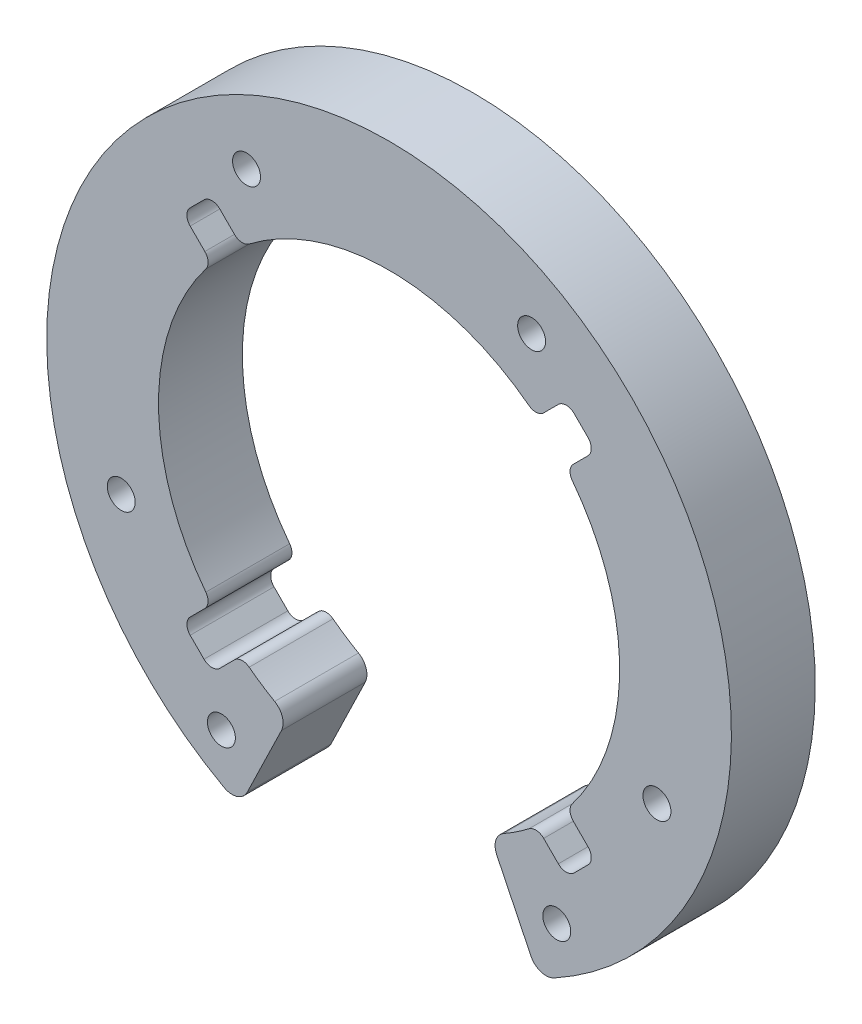
from build123d import *

# Parameters (mm, degrees)
ESQUISSE1_R                  = 61.25
ESQUISSE1_R_2                = 41.25
BOSS_EXTRU_1_DEPTH           = 15
ENL_V_MAT_EXTRU_1_DEPTH      = 88.909754863
ENL_V_MAT_EXTRU_1_DEPTH_BACK = 88.909754863
ENL_V_MAT_EXTRU_2_DEPTH      = 88.909754863
ENL_V_MAT_EXTRU_2_DEPTH_BACK = 88.909754863
CONG_1_R                     = 2
CONG_2_R                     = 3
ENL_V_MAT_EXTRU_3_DEPTH      = 88.909754863
ENL_V_MAT_EXTRU_3_DEPTH_BACK = 88.909754863
ESQUISSE4_R                  = 2.5


with BuildPart() as part:
    # Esquisse1 → Boss.-Extru.1 (new body)
    with BuildSketch(Plane.XY):
        Circle(ESQUISSE1_R)
        Circle(ESQUISSE1_R_2, mode=Mode.SUBTRACT)
    extrude(amount=BOSS_EXTRU_1_DEPTH)

    # Esquisse2 → Enlèv. mat.-Extru.1 (cut, two sides: drawn at the far end of the back side and taken through both)
    with BuildSketch(Plane.XY.offset(15).offset(-ENL_V_MAT_EXTRU_1_DEPTH_BACK)):
        Polygon((26.395724667, 31.699025526), (31.699025526, 26.395724667), (37.002326385, 31.699025526), (31.699025526, 37.002326385), align=None)
        Polygon((31.699025526, -26.395724667), (26.395724667, -31.699025526), (31.699025526, -37.002326385), (37.002326385, -31.699025526), align=None)
        Polygon((-26.395724667, -31.699025526), (-31.699025526, -26.395724667), (-37.002326385, -31.699025526), (-31.699025526, -37.002326385), align=None)
        Polygon((-31.699025526, 26.395724667), (-26.395724667, 31.699025526), (-31.699025526, 37.002326385), (-37.002326385, 31.699025526), align=None)
    extrude(amount=ENL_V_MAT_EXTRU_1_DEPTH + ENL_V_MAT_EXTRU_1_DEPTH_BACK, mode=Mode.SUBTRACT)

    # Esquisse3 → Enlèv. mat.-Extru.2 (cut, two sides: drawn at the far end of the back side and taken through both)
    with BuildSketch(Plane.XY.offset(15).offset(-ENL_V_MAT_EXTRU_2_DEPTH_BACK)):
        with BuildLine():
            Line((-26.727272727, -55.110937141), (-18, -37.115529095))
            ThreePointArc((-18, -37.115529095), (0, -41.25), (18, -37.115529095))
            Line((18, -37.115529095), (26.727272727, -55.110937141))
            ThreePointArc((26.727272727, -55.110937141), (0, -61.25), (-26.727272727, -55.110937141))
        make_face()
    extrude(amount=ENL_V_MAT_EXTRU_2_DEPTH + ENL_V_MAT_EXTRU_2_DEPTH_BACK, mode=Mode.SUBTRACT)

    # Congé1
    cong_1_edges = [part.edges().sort_by_distance(p)[0] for p in [
        (-31.699025526, 37.002326385, 7.5),
        (-26.395724667, 31.699025526, 7.5),
        (-31.699025526, 26.395724667, 7.5),
        (-37.002326385, 31.699025526, 7.5),
        (-37.002326385, -31.699025526, 7.5),
        (-31.699025526, -26.395724667, 7.5),
        (-26.395724667, -31.699025526, 7.5),
        (-31.699025526, -37.002326385, 7.5),
        (31.699025526, -37.002326385, 7.5),
        (26.395724667, -31.699025526, 7.5),
        (31.699025526, -26.395724667, 7.5),
        (37.002326385, -31.699025526, 7.5),
        (37.002326385, 31.699025526, 7.5),
        (31.699025526, 26.395724667, 7.5),
        (26.395724667, 31.699025526, 7.5),
        (31.699025526, 37.002326385, 7.5),
    ]]
    fillet(cong_1_edges, radius=CONG_1_R)

    # Congé2
    cong_2_edges = [part.edges().sort_by_distance(p)[0] for p in [
        (-18, -37.115529095, 7.5),
        (18, -37.115529095, 7.5),
        (26.727272727, -55.110937141, 7.5),
        (-26.727272727, -55.110937141, 7.5),
    ]]
    fillet(cong_2_edges, radius=CONG_2_R)

    # Esquisse4 → Enlèv. mat.-Extru.3 (cut, two sides: drawn at the far end of the back side and taken through both)
    with BuildSketch(Plane.XY.offset(15).offset(-ENL_V_MAT_EXTRU_3_DEPTH_BACK)):
        with Locations((-30, -45)):
            Circle(ESQUISSE4_R)
        with Locations((30, -45)):
            Circle(ESQUISSE4_R)
        with Locations((-47.92432366, -17.44302731)):
            Circle(ESQUISSE4_R)
        with Locations((-25.5, 44.167295593)):
            Circle(ESQUISSE4_R)
        with Locations((25.5, 44.167295593)):
            Circle(ESQUISSE4_R)
        with Locations((47.92432366, -17.44302731)):
            Circle(ESQUISSE4_R)
    extrude(amount=ENL_V_MAT_EXTRU_3_DEPTH + ENL_V_MAT_EXTRU_3_DEPTH_BACK, mode=Mode.SUBTRACT)


solid = part.part
